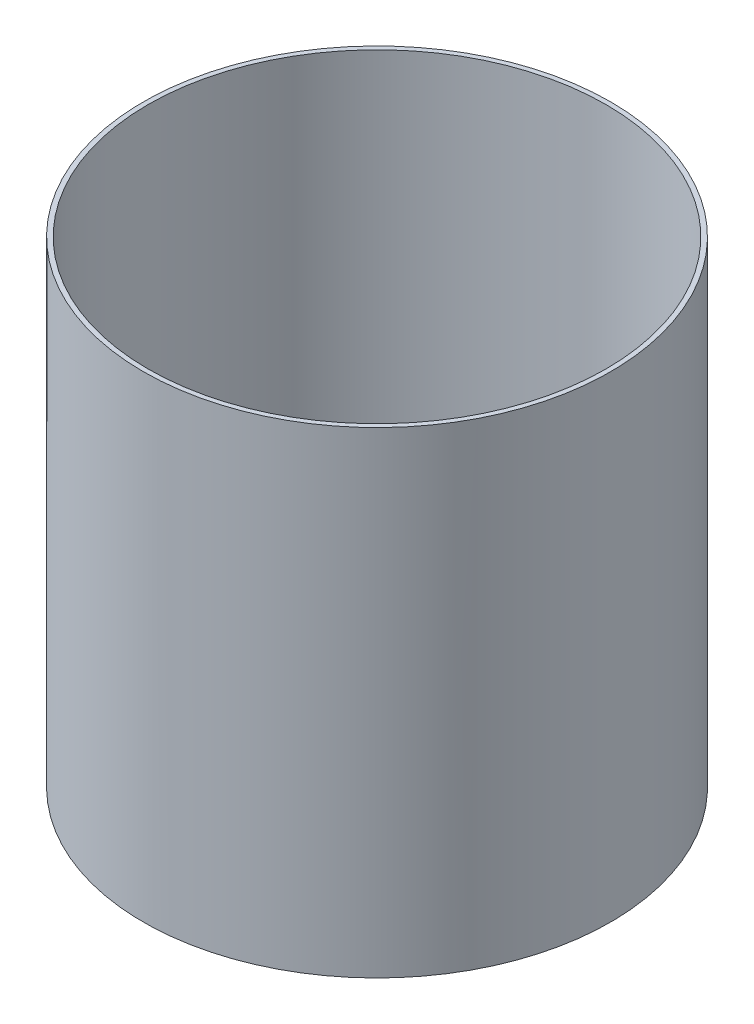
from build123d import *

# Parameters (mm, degrees)
SKETCH1_R           = 50
SKETCH1_R_2         = 49
BOSS_EXTRUDE1_DEPTH = 100
BOSS_EXTRUDE2_START = 2
SKETCH2_R           = 50
BOSS_EXTRUDE2_DEPTH = 2


with BuildPart() as part:
    # Sketch1 → Boss-Extrude1 (new body)
    with BuildSketch(Plane(origin=(0, 0, 0), x_dir=(1, 0, 0), z_dir=(0, 1, 0))):
        with Locations(Location((0, 0, 0), (0, 0, 270))):
            Circle(SKETCH1_R)
        with Locations(Location((0, 0, 0), (0, 0, 270))):
            Circle(SKETCH1_R_2, mode=Mode.SUBTRACT)
    extrude(amount=BOSS_EXTRUDE1_DEPTH)

    # Sketch2 → Boss-Extrude2 (add)
    with BuildSketch(Plane.XZ.offset(BOSS_EXTRUDE2_START)):
        with Locations(Location((0, 0, 0), (0, 0, 270))):
            Circle(SKETCH2_R)
    extrude(amount=-BOSS_EXTRUDE2_DEPTH)


solid = part.part
